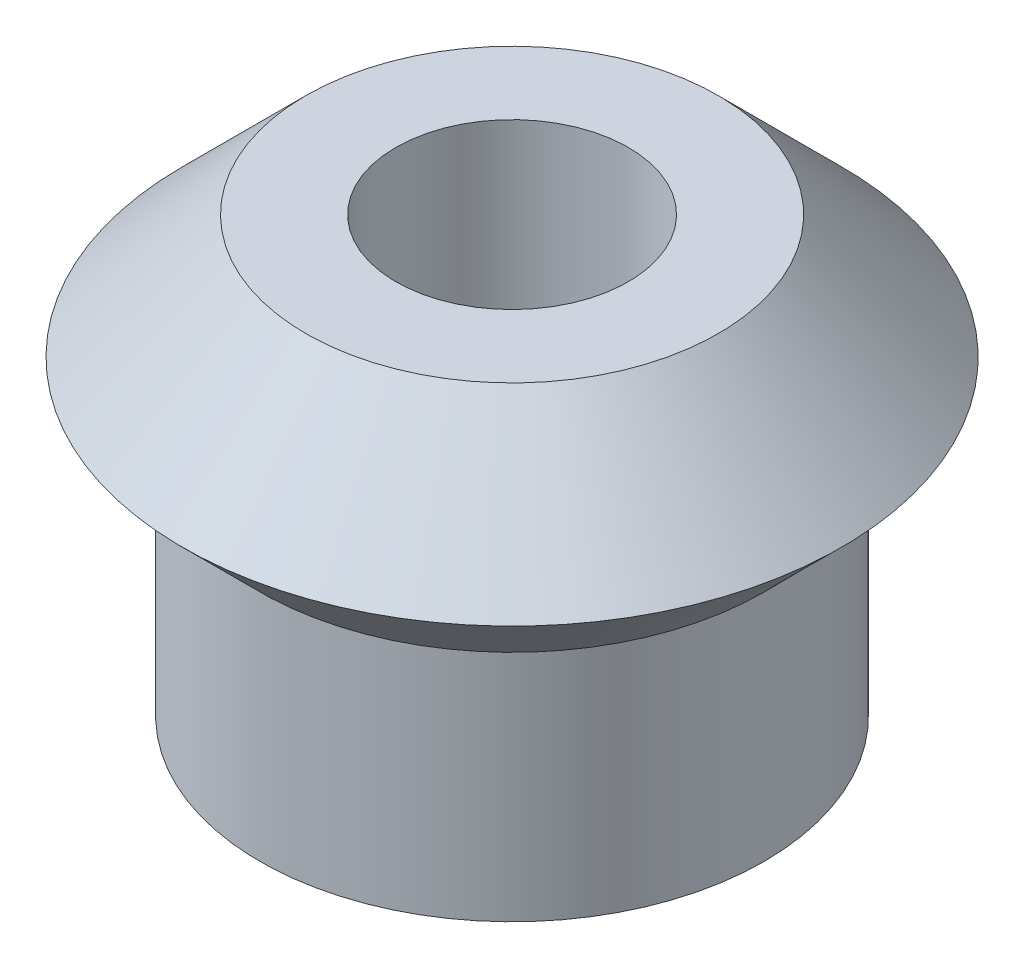
from build123d import *

# Parameters (mm, degrees)
ESQUISSE2_R             = 3
ENL_V_MAT_EXTRU_1_DEPTH = 17.429850882


with BuildPart() as part:
    # Esquisse1 → Révolution1 (revolve)
    with BuildSketch(Plane.XY):
        Polygon((0, 0), (-6.5, 0), (-6.5, 6.018019485), (-8.5, 8.018019485), (-5.318019485, 11.2), (0, 11.2), align=None)
    revolve(axis=Axis((0, 11.2, 0), (0, -1, 0)))

    # Esquisse2 → Enlèv. mat.-Extru.1 (cut, through all)
    with BuildSketch(Plane(origin=(0, 11.2, 0), x_dir=(1, 0, 0), z_dir=(0, 1, 0))):
        with Locations(Location((0, 0, 0), (0, 0, 180))):
            Circle(ESQUISSE2_R)
    extrude(amount=-ENL_V_MAT_EXTRU_1_DEPTH, mode=Mode.SUBTRACT)


solid = part.part
